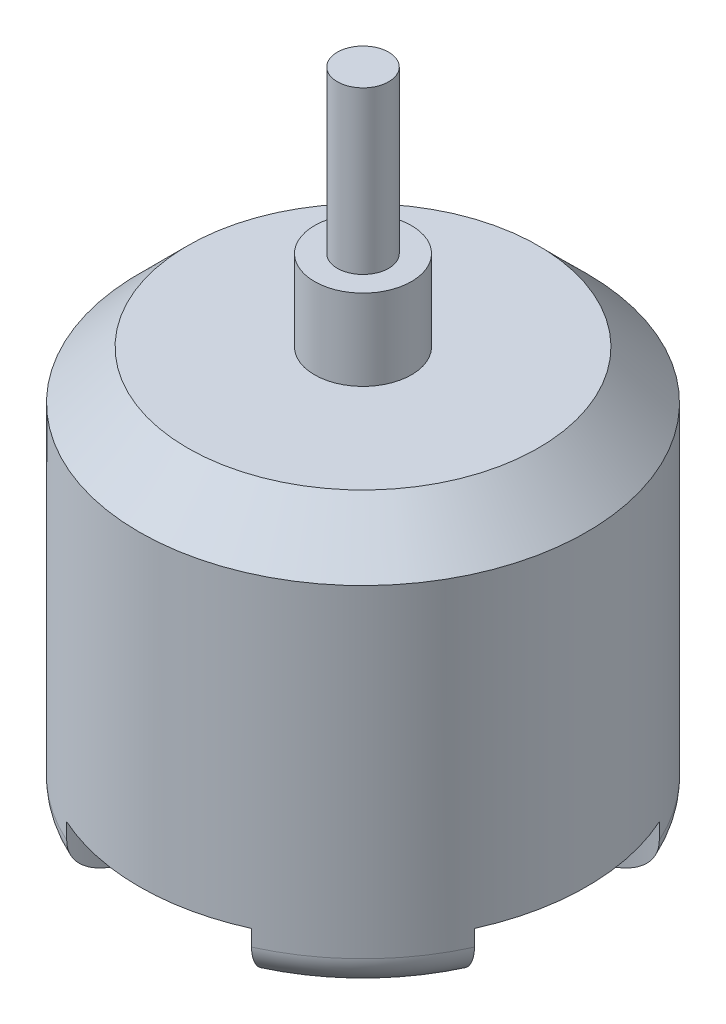
from build123d import *

# Parameters (mm, degrees)
EXTRUDE_1_DEPTH        = 3
FILLET_1_R             = 2
HOLE_WIZARD_M3_1_D     = 3.4
HOLE_WIZARD_M3_1_DEPTH = 7
HOLE_WIZARD_M3_1_TIP   = 1.021463052
SKETCH_10_R            = 5
EXTRUDE_2_DEPTH        = 1


with BuildPart() as part:
    # 스케치1 → 회전1 (revolve)
    with BuildSketch(Plane.XY, mode=Mode.PRIVATE) as revolve_1_sk:
        Polygon((0, 0), (13.85, 0), (13.85, 19), (10.85, 22), (3, 22), (3, 27), (1.5875, 27), (1.5875, 37), (0, 37), align=None)
    revolve(revolve_1_sk.sketch.rotate(Axis((0, 0, 0), (0, -1, 0)), 90), axis=Axis((0, 0, 0), (0, -1, 0)))

    # 스케치2 → 보스-돌출1 (add)
    with BuildSketch(Plane.XZ):
        with BuildLine():
            ThreePointArc((12.614530686, -5.718051729), (8, 0), (12.614530686, 5.718051729))
            ThreePointArc((12.614530686, 5.718051729), (9.793428919, 9.793428919), (5.718051729, 12.614530686))
            ThreePointArc((5.718051729, 12.614530686), (0, 8), (-5.718051729, 12.614530686))
            ThreePointArc((-5.718051729, 12.614530686), (-9.793428919, 9.793428919), (-12.614530686, 5.718051729))
            ThreePointArc((-12.614530686, 5.718051729), (-8, 0), (-12.614530686, -5.718051729))
            ThreePointArc((-12.614530686, -5.718051729), (-9.793428919, -9.793428919), (-5.718051729, -12.614530686))
            ThreePointArc((-5.718051729, -12.614530686), (0, -8), (5.718051729, -12.614530686))
            ThreePointArc((5.718051729, -12.614530686), (9.793428919, -9.793428919), (12.614530686, -5.718051729))
        make_face()
    extrude(amount=EXTRUDE_1_DEPTH)

    # 필렛1
    fillet_1_edges = [part.edges().sort_by_distance(p)[0] for p in [
        (-9.793428919, -3, -9.793428919),
        (9.793428919, -3, -9.793428919),
        (9.793428919, -3, 9.793428919),
        (-9.793428919, -3, 9.793428919),
    ]]
    fillet(fillet_1_edges, radius=FILLET_1_R)

    # M3 여유 구멍1
    with Locations(Plane(origin=(0, -3, 0), x_dir=(-1, 0, 0), z_dir=(0, -1, 0))):
        with Locations((5.656854249, -5.656854249), (-5.656854249, 5.656854249), (-6.717514421, -6.717514421), (6.717514421, 6.717514421)):
            Hole(HOLE_WIZARD_M3_1_D / 2, depth=HOLE_WIZARD_M3_1_DEPTH)
            with Locations((0, 0, -(HOLE_WIZARD_M3_1_DEPTH + HOLE_WIZARD_M3_1_TIP / 2))):  # 118° drill point
                Cone(0, HOLE_WIZARD_M3_1_D / 2, HOLE_WIZARD_M3_1_TIP, mode=Mode.SUBTRACT)

    # 스케치10 → 보스-돌출2 (add)
    with BuildSketch(Plane.XZ.offset(3)):
        with Locations(Location((0, 0, 0), (0, 0, 270))):
            Circle(SKETCH_10_R)
    extrude(amount=EXTRUDE_2_DEPTH)


solid = part.part
